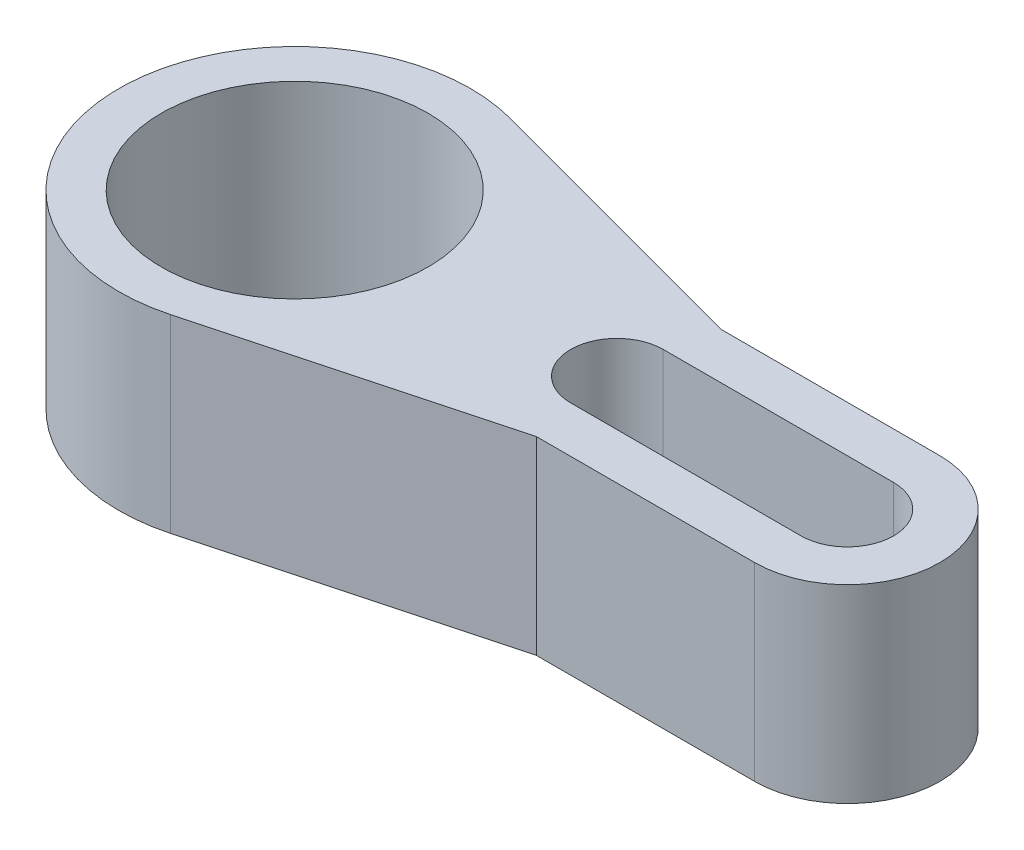
from build123d import *

# Parameters (mm, degrees)
SKETCH1_R           = 9.145
BOSS_EXTRUDE3_DEPTH = 13


with BuildPart() as part:
    # Sketch1 → Boss-Extrude3 (new body)
    with BuildSketch(Plane(origin=(0, 0, 0), x_dir=(1, 0, 0), z_dir=(0, 1, 0))):
        with BuildLine():
            Line((22.935251834, 6.35), (3.119976244, 11.654611672))
            ThreePointArc((3.119976244, 11.654611672), (-12.065, 0), (3.119976244, -11.654611672))
            Line((3.119976244, -11.654611672), (22.935251834, -6.35))
            Line((22.935251834, -6.35), (37.9, -6.35))
            ThreePointArc((37.9, -6.35), (44.25, 0), (37.9, 6.35))
            Line((37.9, 6.35), (22.935251834, 6.35))
        make_face()
        with Locations(Location((0, 0, 0), (0, 0, 90))):
            Circle(SKETCH1_R, mode=Mode.SUBTRACT)
        with BuildLine():
            Line((37.9, -3.175), (22.1, -3.175))
            ThreePointArc((22.1, -3.175), (18.925, 0), (22.1, 3.175))
            Line((22.1, 3.175), (37.9, 3.175))
            ThreePointArc((37.9, 3.175), (41.075, 0), (37.9, -3.175))
        make_face(mode=Mode.SUBTRACT)
    extrude(amount=BOSS_EXTRUDE3_DEPTH)


solid = part.part
